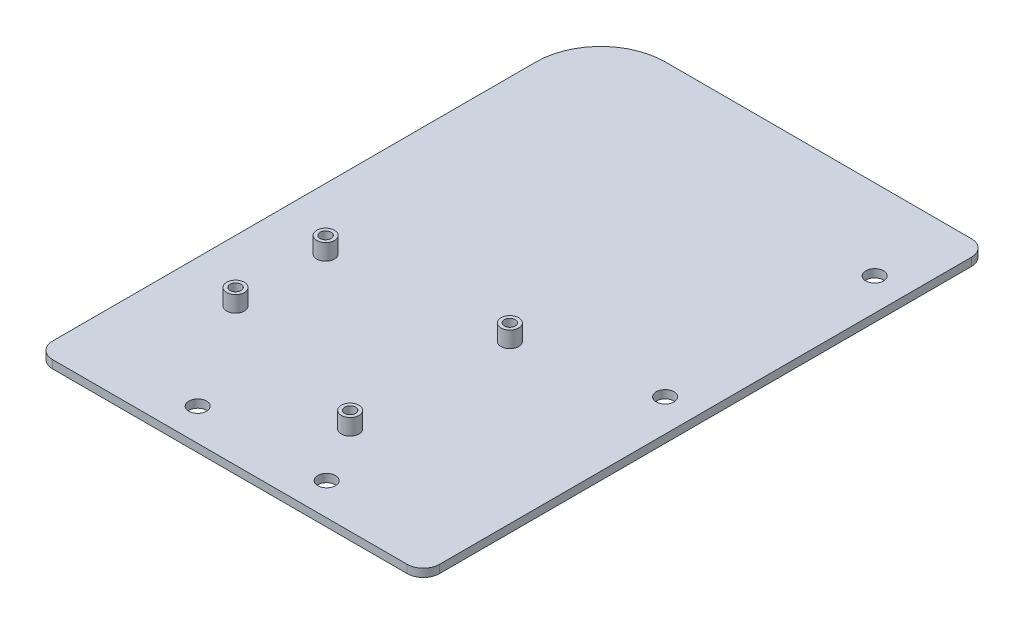
from build123d import *

# Parameters (mm, degrees)
SKETCH1_W            = 120
SKETCH1_H            = 175
BOSS_EXTRUDE1_DEPTH  = 2.5
M5_CLEARANCE_HOLE1_D = 5.5
M3_CLEARANCE_HOLE2_D = 3.4
FILLET1_R            = 20
FILLET2_R            = 5
SKETCH11_R           = 2.750000000000002
SKETCH11_R_2         = 1.699999999999985
BOSS_EXTRUDE3_DEPTH  = 5


with BuildPart() as part:
    # Sketch1 → Boss-Extrude1 (new body)
    with BuildSketch(Plane(origin=(0, 0, 0), x_dir=(1, 0, 0), z_dir=(0, 1, 0))):
        Rectangle(SKETCH1_W, SKETCH1_H)
    extrude(amount=BOSS_EXTRUDE1_DEPTH)

    # M5 Clearance Hole1 (through all)
    with Locations(Plane(origin=(0, 2.5, 0), x_dir=(1, 0, 0), z_dir=(0, 1, 0))):
        with Locations((50, 62.5), (50, -2.5), (-20, -77.5), (20, -77.5)):
            Hole(M5_CLEARANCE_HOLE1_D / 2)

    # M3 Clearance Hole2 (through all)
    with Locations(Plane(origin=(0, 2.5, 0), x_dir=(1, 0, 0), z_dir=(0, 1, 0))):
        with Locations((9.76, -59.96), (11.03, -11.7), (-41.04, -44.72), (-41.04, -16.78)):
            Hole(M3_CLEARANCE_HOLE2_D / 2)

    # Fillet1
    fillet1_edges = [part.edges().sort_by_distance(p)[0] for p in [
        (-59.99999999999998, 1.25, -87.50000000000001),
    ]]
    fillet(fillet1_edges, radius=FILLET1_R)

    # Fillet2
    fillet2_edges = [part.edges().sort_by_distance(p)[0] for p in [
        (60.00000000000002, 1.25, 87.49999999999999),
        (-59.99999999999998, 1.25, 87.49999999999999),
        (60.00000000000002, 1.25, -87.50000000000001),
    ]]
    fillet(fillet2_edges, radius=FILLET2_R)

    # Sketch11 → Boss-Extrude3 (add)
    with BuildSketch(Plane(origin=(0, 2.5, 0), x_dir=(1, 0, 0), z_dir=(0, 1, 0))):
        with Locations(Location((-41.039999999999964, -16.779999999999983, 0), (0, 0, 90))):
            Circle(SKETCH11_R)
        with Locations(Location((-41.039999999999964, -16.779999999999983, 0), (0, 0, 270))):
            Circle(SKETCH11_R_2, mode=Mode.SUBTRACT)
    boss_extrude3 = extrude(amount=BOSS_EXTRUDE3_DEPTH)

    # Sketch-Pattern2: Boss-Extrude3 at 3 more places
    with Locations((50.8, 0, 43.18), (52.07, 0, -5.08), (0, 0, 27.94)):
        add(boss_extrude3)


solid = part.part
